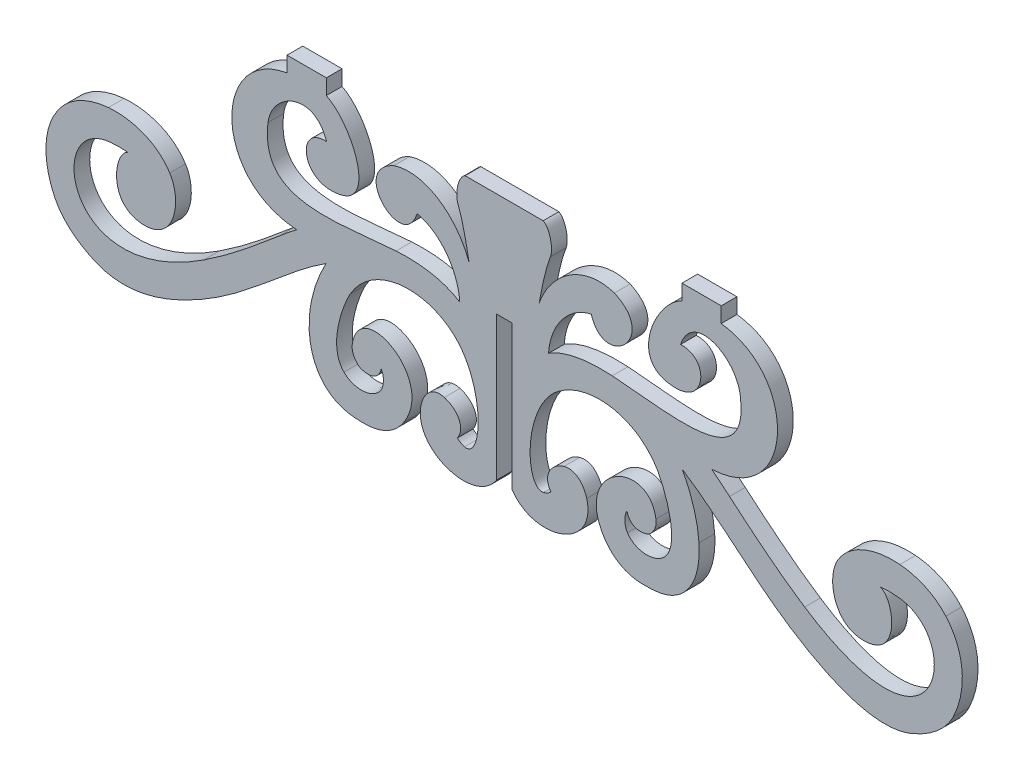
from build123d import *

# Parameters (mm, degrees)
RESSALTO_EXTRUS_O2_DEPTH = 1


with BuildPart() as part:
    # Model → Ressalto-extrusão2 (new, symmetric)
    with BuildSketch(Plane.XY):
        with BuildLine():
            Line((-6.7223, 87.0948), (1.611, 87.0948))
            Line((1.611, 87.0948), (2.4147, 87.0948))
            add(Edge.make_bspline(
                [(3.3382, 83.5924), (3.7126, 84.5367), (3.2989, 86.6387), (2.4147, 87.0948)],
                knots=[0.440860215, 0.440860215, 0.440860215, 0.440860215, 0.451612903, 0.451612903, 0.451612903, 0.451612903], degree=3))
            add(Edge.make_bspline(
                [(1.9007, 77.7655), (2.1973, 79.4462), (2.7131, 82.0156), (3.3382, 83.5924)],
                knots=[0.430107527, 0.430107527, 0.430107527, 0.430107527, 0.440860215, 0.440860215, 0.440860215, 0.440860215], degree=3))
            add(Edge.make_bspline(
                [(11.4777, 83.6641), (7.6336, 84.9355), (3.4642, 82.1115), (1.9007, 77.7655)],
                knots=[0.419354839, 0.419354839, 0.419354839, 0.419354839, 0.430107527, 0.430107527, 0.430107527, 0.430107527], degree=3))
            add(Edge.make_bspline(
                [(8.5335, 79.8535), (10.2661, 74.3684), (17.3019, 81.012), (11.4777, 83.6641)],
                knots=[0.408602151, 0.408602151, 0.408602151, 0.408602151, 0.419354839, 0.419354839, 0.419354839, 0.419354839], degree=3))
            add(Edge.make_bspline(
                [(3.0953, 72.8221), (3.2894, 76.0459), (5.5232, 79.2191), (8.5335, 79.8535)],
                knots=[0.397849462, 0.397849462, 0.397849462, 0.397849462, 0.408602151, 0.408602151, 0.408602151, 0.408602151], degree=3))
            add(Edge.make_bspline(
                [(11.2069, 74.3959), (8.4975, 74.5655), (5.4129, 74.2948), (3.0953, 72.8221)],
                knots=[0.387096774, 0.387096774, 0.387096774, 0.387096774, 0.397849462, 0.397849462, 0.397849462, 0.397849462], degree=3))
            add(Edge.make_bspline(
                [(27.5035, 80.4182), (28.8335, 71.3912), (18.3639, 73.948), (11.2069, 74.3959)],
                knots=[0.376344086, 0.376344086, 0.376344086, 0.376344086, 0.387096774, 0.387096774, 0.387096774, 0.387096774], degree=3))
            add(Edge.make_bspline(
                [(19.9017, 82.1957), (21.4782, 86.8801), (26.9279, 84.3257), (27.5035, 80.4182)],
                knots=[0.365591398, 0.365591398, 0.365591398, 0.365591398, 0.376344086, 0.376344086, 0.376344086, 0.376344086], degree=3))
            add(Edge.make_bspline(
                [(19.324, 77.092), (23.2759, 77.0876), (23.5759, 82.3662), (19.9017, 82.1957)],
                knots=[0.35483871, 0.35483871, 0.35483871, 0.35483871, 0.365591398, 0.365591398, 0.365591398, 0.365591398], degree=3))
            add(Edge.make_bspline(
                [(20.0819, 87.0936), (16.6077, 85.432), (12.9409, 77.0991), (19.324, 77.092)],
                knots=[0.344086022, 0.344086022, 0.344086022, 0.344086022, 0.35483871, 0.35483871, 0.35483871, 0.35483871], degree=3))
            Line((20.0819, 87.0936), (20.0819, 89.0522))
            Line((20.0819, 89.0522), (25.0819, 89.0522))
            Line((25.0819, 89.0522), (25.0819, 87.0936))
            add(Edge.make_bspline(
                [(23.8569, 70.4159), (34.6371, 71.0038), (35.0189, 85.8605), (25.0819, 87.0936)],
                knots=[0.301075269, 0.301075269, 0.301075269, 0.301075269, 0.311827957, 0.311827957, 0.311827957, 0.311827957], degree=3))
            add(Edge.make_bspline(
                [(26.1424, 68.5597), (25.3878, 69.2011), (24.6507, 69.8283), (23.8569, 70.4159)],
                knots=[0.290322581, 0.290322581, 0.290322581, 0.290322581, 0.301075269, 0.301075269, 0.301075269, 0.301075269], degree=3))
            add(Edge.make_bspline(
                [(35.7039, 61.1512), (32.3225, 63.358), (29.2308, 65.9343), (26.1424, 68.5597)],
                knots=[0.279569892, 0.279569892, 0.279569892, 0.279569892, 0.290322581, 0.290322581, 0.290322581, 0.290322581], degree=3))
            add(Edge.make_bspline(
                [(47.5444, 68.1978), (56.1288, 67.4587), (53.2372, 49.7095), (35.7039, 61.1512)],
                knots=[0.268817204, 0.268817204, 0.268817204, 0.268817204, 0.279569892, 0.279569892, 0.279569892, 0.279569892], degree=3))
            add(Edge.make_bspline(
                [(45.378, 68.1822), (45.5771, 68.196), (46.0949, 68.3226), (47.5444, 68.1978)],
                knots=[0.258064516, 0.258064516, 0.258064516, 0.258064516, 0.268817204, 0.268817204, 0.268817204, 0.268817204], degree=3))
            add(Edge.make_bspline(
                [(43.3399, 61.2103), (47.9822, 61.3536), (47.1577, 67.4304), (45.378, 68.1822)],
                knots=[0.247311828, 0.247311828, 0.247311828, 0.247311828, 0.258064516, 0.258064516, 0.258064516, 0.258064516], degree=3))
            add(Edge.make_bspline(
                [(40.0071, 68.5733), (38.437, 66.1625), (39.309, 61.0858), (43.3399, 61.2103)],
                knots=[0.23655914, 0.23655914, 0.23655914, 0.23655914, 0.247311828, 0.247311828, 0.247311828, 0.247311828], degree=3))
            add(Edge.make_bspline(
                [(47.8314, 71.902), (44.993, 72.1464), (41.6526, 71.2075), (40.0071, 68.5733)],
                knots=[0.225806452, 0.225806452, 0.225806452, 0.225806452, 0.23655914, 0.23655914, 0.23655914, 0.23655914], degree=3))
            add(Edge.make_bspline(
                [(53.6788, 69.1304), (52.185, 70.8375), (49.9939, 71.7158), (47.8314, 71.902)],
                knots=[0.215053763, 0.215053763, 0.215053763, 0.215053763, 0.225806452, 0.225806452, 0.225806452, 0.225806452], degree=3))
            add(Edge.make_bspline(
                [(54.6205, 58.5045), (56.2723, 61.8584), (56.3216, 66.11), (53.6788, 69.1304)],
                knots=[0.204301075, 0.204301075, 0.204301075, 0.204301075, 0.215053763, 0.215053763, 0.215053763, 0.215053763], degree=3))
            add(Edge.make_bspline(
                [(49.1647, 53.947), (51.3704, 54.8066), (53.5508, 56.3326), (54.6205, 58.5045)],
                knots=[0.193548387, 0.193548387, 0.193548387, 0.193548387, 0.204301075, 0.204301075, 0.204301075, 0.204301075], degree=3))
            add(Edge.make_bspline(
                [(33.8482, 57.9913), (38.0156, 55.2717), (44.1924, 52.009), (49.1647, 53.947)],
                knots=[0.182795699, 0.182795699, 0.182795699, 0.182795699, 0.193548387, 0.193548387, 0.193548387, 0.193548387], degree=3))
            add(Edge.make_bspline(
                [(20.1166, 68.56), (24.7894, 65.5652), (28.9378, 61.1957), (33.8482, 57.9913)],
                knots=[0.172043011, 0.172043011, 0.172043011, 0.172043011, 0.182795699, 0.182795699, 0.182795699, 0.182795699], degree=3))
            add(Edge.make_bspline(
                [(22.2511, 61.4956), (22.0962, 63.9402), (21.2748, 66.4447), (20.1166, 68.56)],
                knots=[0.161290323, 0.161290323, 0.161290323, 0.161290323, 0.172043011, 0.172043011, 0.172043011, 0.172043011], degree=3))
            add(Edge.make_bspline(
                [(20.2685, 55.0308), (21.9316, 56.6963), (22.3987, 59.1658), (22.2511, 61.4956)],
                knots=[0.150537634, 0.150537634, 0.150537634, 0.150537634, 0.161290323, 0.161290323, 0.161290323, 0.161290323], degree=3))
            add(Edge.make_bspline(
                [(14.8163, 53.3639), (17.0037, 53.2741), (18.8296, 53.5898), (20.2685, 55.0308)],
                knots=[0.139784946, 0.139784946, 0.139784946, 0.139784946, 0.150537634, 0.150537634, 0.150537634, 0.150537634], degree=3))
            add(Edge.make_bspline(
                [(10.2507, 55.9445), (11.3104, 54.3388), (12.9835, 53.4391), (14.8163, 53.3639)],
                knots=[0.129032258, 0.129032258, 0.129032258, 0.129032258, 0.139784946, 0.139784946, 0.139784946, 0.139784946], degree=3))
            add(Edge.make_bspline(
                [(16.7747, 61.3853), (15.7027, 67.6161), (5.9938, 62.3947), (10.2507, 55.9445)],
                knots=[0.11827957, 0.11827957, 0.11827957, 0.11827957, 0.129032258, 0.129032258, 0.129032258, 0.129032258], degree=3))
            add(Edge.make_bspline(
                [(15.4964, 59.1291), (16.2163, 59.3056), (16.9538, 60.3437), (16.7747, 61.3853)],
                knots=[0.107526882, 0.107526882, 0.107526882, 0.107526882, 0.11827957, 0.11827957, 0.11827957, 0.11827957], degree=3))
            add(Edge.make_bspline(
                [(13.0959, 60.4397), (13.1597, 59.9829), (13.6899, 58.6489), (15.4964, 59.1291)],
                knots=[0.096774194, 0.096774194, 0.096774194, 0.096774194, 0.107526882, 0.107526882, 0.107526882, 0.107526882], degree=3))
            add(Edge.make_bspline(
                [(13.1448, 58.067), (12.7434, 58.6752), (12.6969, 59.8398), (13.0959, 60.4397)],
                knots=[0.086021505, 0.086021505, 0.086021505, 0.086021505, 0.096774194, 0.096774194, 0.096774194, 0.096774194], degree=3))
            add(Edge.make_bspline(
                [(17.8402, 57.7253), (16.5822, 56.4654), (14.1497, 56.5444), (13.1448, 58.067)],
                knots=[0.075268817, 0.075268817, 0.075268817, 0.075268817, 0.086021505, 0.086021505, 0.086021505, 0.086021505], degree=3))
            add(Edge.make_bspline(
                [(17.0509, 66.7244), (18.1854, 64.6611), (19.8274, 59.7153), (17.8402, 57.7253)],
                knots=[0.064516129, 0.064516129, 0.064516129, 0.064516129, 0.075268817, 0.075268817, 0.075268817, 0.075268817], degree=3))
            add(Edge.make_bspline(
                [(4.4458, 69.3227), (8.1489, 72.0987), (14.3081, 71.5264), (17.0509, 66.7244)],
                knots=[0.053763441, 0.053763441, 0.053763441, 0.053763441, 0.064516129, 0.064516129, 0.064516129, 0.064516129], degree=3))
            add(Edge.make_bspline(
                [(2.481, 57.1607), (0.004, 56.5684), (-0.2039, 65.9986), (4.4458, 69.3227)],
                knots=[0.043010753, 0.043010753, 0.043010753, 0.043010753, 0.053763441, 0.053763441, 0.053763441, 0.053763441], degree=3))
            add(Edge.make_bspline(
                [(3.3931, 57.6868), (3.1478, 57.4328), (2.8154, 57.2407), (2.481, 57.1607)],
                knots=[0.032258065, 0.032258065, 0.032258065, 0.032258065, 0.043010753, 0.043010753, 0.043010753, 0.043010753], degree=3))
            add(Edge.make_bspline(
                [(5.0534, 61.3244), (3.6461, 60.926), (2.2466, 59.35), (3.3931, 57.6868)],
                knots=[0.021505376, 0.021505376, 0.021505376, 0.021505376, 0.032258065, 0.032258065, 0.032258065, 0.032258065], degree=3))
            add(Edge.make_bspline(
                [(7.9628, 59.2514), (7.7655, 60.0281), (6.8767, 61.8404), (5.0534, 61.3244)],
                knots=[0.010752688, 0.010752688, 0.010752688, 0.010752688, 0.021505376, 0.021505376, 0.021505376, 0.021505376], degree=3))
            add(Edge.make_bspline(
                [(-1.5557, 55.4934), (1.3324, 51.1828), (9.3145, 53.9302), (7.9628, 59.2514)],
                knots=[0, 0, 0, 0, 0.010752688, 0.010752688, 0.010752688, 0.010752688], degree=3))
            Line((-1.5557, 55.4934), (-1.5557, 73.8415))
            Line((-1.5557, 73.8415), (-3.5557, 73.8415))
            Line((-3.5557, 73.8415), (-3.5557, 55.4934))
            add(Edge.make_bspline(
                [(-13.0741, 59.2514), (-14.4259, 53.9302), (-6.4437, 51.1828), (-3.5557, 55.4934)],
                knots=[0.946236559, 0.946236559, 0.946236559, 0.946236559, 0.956989247, 0.956989247, 0.956989247, 0.956989247], degree=3))
            add(Edge.make_bspline(
                [(-10.1647, 61.3244), (-11.988, 61.8404), (-12.8768, 60.0281), (-13.0741, 59.2514)],
                knots=[0.935483871, 0.935483871, 0.935483871, 0.935483871, 0.946236559, 0.946236559, 0.946236559, 0.946236559], degree=3))
            add(Edge.make_bspline(
                [(-8.5045, 57.6868), (-7.3579, 59.35), (-8.7574, 60.926), (-10.1647, 61.3244)],
                knots=[0.924731183, 0.924731183, 0.924731183, 0.924731183, 0.935483871, 0.935483871, 0.935483871, 0.935483871], degree=3))
            add(Edge.make_bspline(
                [(-7.5923, 57.1607), (-7.9267, 57.2407), (-8.2591, 57.4328), (-8.5045, 57.6868)],
                knots=[0.913978495, 0.913978495, 0.913978495, 0.913978495, 0.924731183, 0.924731183, 0.924731183, 0.924731183], degree=3))
            add(Edge.make_bspline(
                [(-9.5572, 69.3227), (-4.9074, 65.9986), (-5.1153, 56.5684), (-7.5923, 57.1607)],
                knots=[0.903225806, 0.903225806, 0.903225806, 0.903225806, 0.913978495, 0.913978495, 0.913978495, 0.913978495], degree=3))
            add(Edge.make_bspline(
                [(-22.1622, 66.7244), (-19.4194, 71.5264), (-13.2602, 72.0987), (-9.5572, 69.3227)],
                knots=[0.892473118, 0.892473118, 0.892473118, 0.892473118, 0.903225806, 0.903225806, 0.903225806, 0.903225806], degree=3))
            add(Edge.make_bspline(
                [(-22.9516, 57.7253), (-24.9387, 59.7153), (-23.2967, 64.6611), (-22.1622, 66.7244)],
                knots=[0.88172043, 0.88172043, 0.88172043, 0.88172043, 0.892473118, 0.892473118, 0.892473118, 0.892473118], degree=3))
            add(Edge.make_bspline(
                [(-18.2562, 58.067), (-19.261, 56.5444), (-21.6935, 56.4654), (-22.9516, 57.7253)],
                knots=[0.870967742, 0.870967742, 0.870967742, 0.870967742, 0.88172043, 0.88172043, 0.88172043, 0.88172043], degree=3))
            add(Edge.make_bspline(
                [(-18.2072, 60.4397), (-17.8082, 59.8398), (-17.8547, 58.6752), (-18.2562, 58.067)],
                knots=[0.860215054, 0.860215054, 0.860215054, 0.860215054, 0.870967742, 0.870967742, 0.870967742, 0.870967742], degree=3))
            add(Edge.make_bspline(
                [(-20.6077, 59.1291), (-18.8012, 58.6489), (-18.271, 59.9829), (-18.2072, 60.4397)],
                knots=[0.849462366, 0.849462366, 0.849462366, 0.849462366, 0.860215054, 0.860215054, 0.860215054, 0.860215054], degree=3))
            add(Edge.make_bspline(
                [(-21.886, 61.3853), (-22.0651, 60.3437), (-21.3276, 59.3056), (-20.6077, 59.1291)],
                knots=[0.838709677, 0.838709677, 0.838709677, 0.838709677, 0.849462366, 0.849462366, 0.849462366, 0.849462366], degree=3))
            add(Edge.make_bspline(
                [(-15.362, 55.9445), (-11.1052, 62.3947), (-20.814, 67.6161), (-21.886, 61.3853)],
                knots=[0.827956989, 0.827956989, 0.827956989, 0.827956989, 0.838709677, 0.838709677, 0.838709677, 0.838709677], degree=3))
            add(Edge.make_bspline(
                [(-19.9277, 53.3639), (-18.0948, 53.4391), (-16.4217, 54.3388), (-15.362, 55.9445)],
                knots=[0.817204301, 0.817204301, 0.817204301, 0.817204301, 0.827956989, 0.827956989, 0.827956989, 0.827956989], degree=3))
            add(Edge.make_bspline(
                [(-25.3799, 55.0308), (-23.941, 53.5898), (-22.1151, 53.2741), (-19.9277, 53.3639)],
                knots=[0.806451613, 0.806451613, 0.806451613, 0.806451613, 0.817204301, 0.817204301, 0.817204301, 0.817204301], degree=3))
            add(Edge.make_bspline(
                [(-27.3624, 61.4956), (-27.5101, 59.1658), (-27.0429, 56.6963), (-25.3799, 55.0308)],
                knots=[0.795698925, 0.795698925, 0.795698925, 0.795698925, 0.806451613, 0.806451613, 0.806451613, 0.806451613], degree=3))
            add(Edge.make_bspline(
                [(-25.2279, 68.56), (-26.3861, 66.4447), (-27.2075, 63.9402), (-27.3624, 61.4956)],
                knots=[0.784946237, 0.784946237, 0.784946237, 0.784946237, 0.795698925, 0.795698925, 0.795698925, 0.795698925], degree=3))
            add(Edge.make_bspline(
                [(-38.9596, 57.9913), (-34.0491, 61.1957), (-29.9008, 65.5652), (-25.2279, 68.56)],
                knots=[0.774193548, 0.774193548, 0.774193548, 0.774193548, 0.784946237, 0.784946237, 0.784946237, 0.784946237], degree=3))
            add(Edge.make_bspline(
                [(-54.2761, 53.947), (-49.3037, 52.009), (-43.127, 55.2717), (-38.9596, 57.9913)],
                knots=[0.76344086, 0.76344086, 0.76344086, 0.76344086, 0.774193548, 0.774193548, 0.774193548, 0.774193548], degree=3))
            add(Edge.make_bspline(
                [(-59.7318, 58.5045), (-58.6621, 56.3326), (-56.4817, 54.8066), (-54.2761, 53.947)],
                knots=[0.752688172, 0.752688172, 0.752688172, 0.752688172, 0.76344086, 0.76344086, 0.76344086, 0.76344086], degree=3))
            add(Edge.make_bspline(
                [(-58.7901, 69.1304), (-61.433, 66.11), (-61.3836, 61.8584), (-59.7318, 58.5045)],
                knots=[0.741935484, 0.741935484, 0.741935484, 0.741935484, 0.752688172, 0.752688172, 0.752688172, 0.752688172], degree=3))
            add(Edge.make_bspline(
                [(-52.9427, 71.902), (-55.1052, 71.7158), (-57.2964, 70.8375), (-58.7901, 69.1304)],
                knots=[0.731182796, 0.731182796, 0.731182796, 0.731182796, 0.741935484, 0.741935484, 0.741935484, 0.741935484], degree=3))
            add(Edge.make_bspline(
                [(-45.1185, 68.5733), (-46.764, 71.2075), (-50.1044, 72.1464), (-52.9427, 71.902)],
                knots=[0.720430108, 0.720430108, 0.720430108, 0.720430108, 0.731182796, 0.731182796, 0.731182796, 0.731182796], degree=3))
            add(Edge.make_bspline(
                [(-48.4513, 61.2103), (-44.4203, 61.0858), (-43.5483, 66.1625), (-45.1185, 68.5733)],
                knots=[0.709677419, 0.709677419, 0.709677419, 0.709677419, 0.720430108, 0.720430108, 0.720430108, 0.720430108], degree=3))
            add(Edge.make_bspline(
                [(-50.4894, 68.1822), (-52.269, 67.4304), (-53.0935, 61.3536), (-48.4513, 61.2103)],
                knots=[0.698924731, 0.698924731, 0.698924731, 0.698924731, 0.709677419, 0.709677419, 0.709677419, 0.709677419], degree=3))
            add(Edge.make_bspline(
                [(-52.6557, 68.1978), (-51.2062, 68.3226), (-50.6884, 68.196), (-50.4894, 68.1822)],
                knots=[0.688172043, 0.688172043, 0.688172043, 0.688172043, 0.698924731, 0.698924731, 0.698924731, 0.698924731], degree=3))
            add(Edge.make_bspline(
                [(-40.8153, 61.1512), (-58.3485, 49.7095), (-61.2401, 67.4587), (-52.6557, 68.1978)],
                knots=[0.677419355, 0.677419355, 0.677419355, 0.677419355, 0.688172043, 0.688172043, 0.688172043, 0.688172043], degree=3))
            add(Edge.make_bspline(
                [(-31.2537, 68.5597), (-34.3422, 65.9343), (-37.4338, 63.358), (-40.8153, 61.1512)],
                knots=[0.666666667, 0.666666667, 0.666666667, 0.666666667, 0.677419355, 0.677419355, 0.677419355, 0.677419355], degree=3))
            add(Edge.make_bspline(
                [(-28.9683, 70.4159), (-29.7621, 69.8283), (-30.4992, 69.2011), (-31.2537, 68.5597)],
                knots=[0.655913978, 0.655913978, 0.655913978, 0.655913978, 0.666666667, 0.666666667, 0.666666667, 0.666666667], degree=3))
            add(Edge.make_bspline(
                [(-30.1933, 87.0941), (-39.689, 85.4201), (-39.8369, 71.1802), (-28.9683, 70.4159)],
                knots=[0.64516129, 0.64516129, 0.64516129, 0.64516129, 0.655913978, 0.655913978, 0.655913978, 0.655913978], degree=3))
            Line((-30.1933, 87.0941), (-30.1933, 89.0522))
            Line((-30.1933, 89.0522), (-25.1933, 89.0522))
            Line((-25.1933, 89.0522), (-25.1933, 87.0941))
            add(Edge.make_bspline(
                [(-24.5897, 76.9377), (-18.2058, 76.9448), (-21.7201, 85.433), (-25.1933, 87.0941)],
                knots=[0.602150538, 0.602150538, 0.602150538, 0.602150538, 0.612903226, 0.612903226, 0.612903226, 0.612903226], degree=3))
            add(Edge.make_bspline(
                [(-25.1674, 82.0414), (-28.8415, 82.2119), (-28.5416, 76.9333), (-24.5897, 76.9377)],
                knots=[0.591397849, 0.591397849, 0.591397849, 0.591397849, 0.602150538, 0.602150538, 0.602150538, 0.602150538], degree=3))
            add(Edge.make_bspline(
                [(-32.6149, 80.4182), (-32.1511, 84.1391), (-26.7439, 86.7258), (-25.1674, 82.0414)],
                knots=[0.580645161, 0.580645161, 0.580645161, 0.580645161, 0.591397849, 0.591397849, 0.591397849, 0.591397849], degree=3))
            add(Edge.make_bspline(
                [(-16.3182, 74.3959), (-23.4752, 73.948), (-33.7433, 71.3639), (-32.6149, 80.4182)],
                knots=[0.569892473, 0.569892473, 0.569892473, 0.569892473, 0.580645161, 0.580645161, 0.580645161, 0.580645161], degree=3))
            add(Edge.make_bspline(
                [(-8.2066, 72.8221), (-10.5242, 74.2948), (-13.6088, 74.5655), (-16.3182, 74.3959)],
                knots=[0.559139785, 0.559139785, 0.559139785, 0.559139785, 0.569892473, 0.569892473, 0.569892473, 0.569892473], degree=3))
            add(Edge.make_bspline(
                [(-13.6449, 79.8535), (-10.6345, 79.2191), (-8.4007, 76.0459), (-8.2066, 72.8221)],
                knots=[0.548387097, 0.548387097, 0.548387097, 0.548387097, 0.559139785, 0.559139785, 0.559139785, 0.559139785], degree=3))
            add(Edge.make_bspline(
                [(-16.589, 83.6641), (-22.4132, 81.012), (-15.3774, 74.3684), (-13.6449, 79.8535)],
                knots=[0.537634409, 0.537634409, 0.537634409, 0.537634409, 0.548387097, 0.548387097, 0.548387097, 0.548387097], degree=3))
            add(Edge.make_bspline(
                [(-7.0121, 77.7655), (-8.5755, 82.1115), (-12.7449, 84.9355), (-16.589, 83.6641)],
                knots=[0.52688172, 0.52688172, 0.52688172, 0.52688172, 0.537634409, 0.537634409, 0.537634409, 0.537634409], degree=3))
            add(Edge.make_bspline(
                [(-8.4495, 83.5924), (-7.8244, 82.0156), (-7.3086, 79.4462), (-7.0121, 77.7655)],
                knots=[0.516129032, 0.516129032, 0.516129032, 0.516129032, 0.52688172, 0.52688172, 0.52688172, 0.52688172], degree=3))
            add(Edge.make_bspline(
                [(-7.526, 87.0948), (-8.4102, 86.6387), (-8.8239, 84.5367), (-8.4495, 83.5924)],
                knots=[0.505376344, 0.505376344, 0.505376344, 0.505376344, 0.516129032, 0.516129032, 0.516129032, 0.516129032], degree=3))
            Line((-7.526, 87.0948), (-6.7223, 87.0948))
        make_face()
    extrude(amount=RESSALTO_EXTRUS_O2_DEPTH, both=True)


solid = part.part
